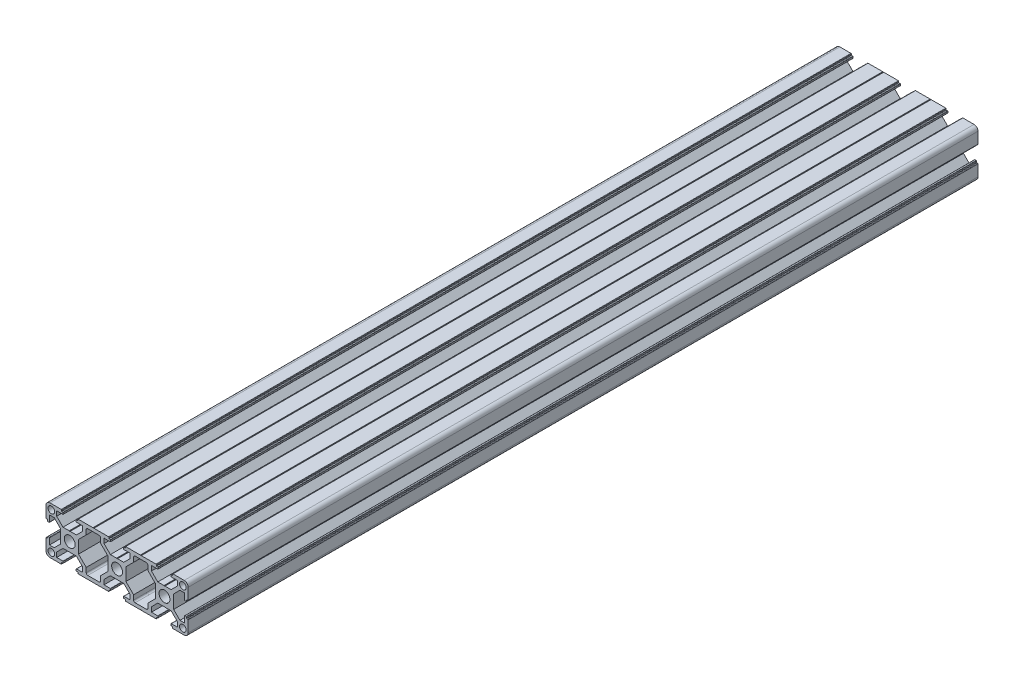
from build123d import *

# Parameters (mm, degrees)
SKETCH_1_R      = 2.1
SKETCH_1_R_2    = 3.45
EXTRUDE_1_DEPTH = 500


with BuildPart() as part:
    # Эскиз1 → Бобышка-Вытянуть1 (new body)
    with BuildSketch(Plane(origin=(0, 500, 0), x_dir=(1, 0, 0), z_dir=(0, 0, -1))):
        with BuildLine():
            Line((15.337695265, -15), (24.6, -15))
            ThreePointArc((24.6, -15), (24.741421356, -14.941421356), (24.8, -14.8))
            Line((24.8, -14.8), (24.8, -14.2))
            ThreePointArc((24.8, -14.2), (24.858578644, -14.058578644), (25, -14))
            Line((25, -14), (25.7, -14))
            ThreePointArc((25.7, -14), (25.841421356, -13.941421356), (25.9, -13.8))
            Line((25.9, -13.8), (25.9, -13))
            ThreePointArc((25.9, -13), (25.841421356, -12.858578644), (25.7, -12.8))
            Line((25.7, -12.8), (21.75, -12.8))
            Line((21.75, -12.8), (21.75, -9.805634919))
            Line((21.75, -9.805634919), (25.755634919, -5.8))
            Line((25.755634919, -5.8), (29.662304735, -5.8))
            ThreePointArc((29.662304735, -5.8), (29.745056471, -5.78590708), (29.818478497, -5.745217202))
            Line((29.818478497, -5.745217202), (30, -5.6))
            Line((30, -5.6), (30.181521503, -5.745217202))
            ThreePointArc((30.181521503, -5.745217202), (30.254943529, -5.78590708), (30.337695265, -5.8))
            Line((30.337695265, -5.8), (34.244365081, -5.8))
            Line((34.244365081, -5.8), (38.25, -9.805634919))
            Line((38.25, -9.805634919), (38.25, -12.8))
            Line((38.25, -12.8), (34.3, -12.8))
            ThreePointArc((34.3, -12.8), (34.158578644, -12.858578644), (34.1, -13))
            Line((34.1, -13), (34.1, -13.8))
            ThreePointArc((34.1, -13.8), (34.158578644, -13.941421356), (34.3, -14))
            Line((34.3, -14), (35, -14))
            ThreePointArc((35, -14), (35.141421356, -14.058578644), (35.2, -14.2))
            Line((35.2, -14.2), (35.2, -14.8))
            ThreePointArc((35.2, -14.8), (35.258578644, -14.941421356), (35.4, -15))
            Line((35.4, -15), (42.5, -15))
            ThreePointArc((42.5, -15), (44.267766953, -14.267766953), (45, -12.5))
            Line((45, -12.5), (45, -5.4))
            ThreePointArc((45, -5.4), (44.941421356, -5.258578644), (44.8, -5.2))
            Line((44.8, -5.2), (44.2, -5.2))
            ThreePointArc((44.2, -5.2), (44.058578644, -5.141421356), (44, -5))
            Line((44, -5), (44, -4.3))
            ThreePointArc((44, -4.3), (43.941421356, -4.158578644), (43.8, -4.1))
            Line((43.8, -4.1), (43, -4.1))
            ThreePointArc((43, -4.1), (42.858578644, -4.158578644), (42.8, -4.3))
            Line((42.8, -4.3), (42.8, -8.25))
            Line((42.8, -8.25), (39.805634919, -8.25))
            Line((39.805634919, -8.25), (35.8, -4.244365081))
            Line((35.8, -4.244365081), (35.8, 4.244365081))
            Line((35.8, 4.244365081), (39.805634919, 8.25))
            Line((39.805634919, 8.25), (42.8, 8.25))
            Line((42.8, 8.25), (42.8, 4.3))
            ThreePointArc((42.8, 4.3), (42.858578644, 4.158578644), (43, 4.1))
            Line((43, 4.1), (43.8, 4.1))
            ThreePointArc((43.8, 4.1), (43.941421356, 4.158578644), (44, 4.3))
            Line((44, 4.3), (44, 5))
            ThreePointArc((44, 5), (44.058578644, 5.141421356), (44.2, 5.2))
            Line((44.2, 5.2), (44.8, 5.2))
            ThreePointArc((44.8, 5.2), (44.941421356, 5.258578644), (45, 5.4))
            Line((45, 5.4), (45, 12.5))
            ThreePointArc((45, 12.5), (44.267766953, 14.267766953), (42.5, 15))
            Line((42.5, 15), (35.4, 15))
            ThreePointArc((35.4, 15), (35.258578644, 14.941421356), (35.2, 14.8))
            Line((35.2, 14.8), (35.2, 14.2))
            ThreePointArc((35.2, 14.2), (35.141421356, 14.058578644), (35, 14))
            Line((35, 14), (34.3, 14))
            ThreePointArc((34.3, 14), (34.158578644, 13.941421356), (34.1, 13.8))
            Line((34.1, 13.8), (34.1, 13))
            ThreePointArc((34.1, 13), (34.158578644, 12.858578644), (34.3, 12.8))
            Line((34.3, 12.8), (38.25, 12.8))
            Line((38.25, 12.8), (38.25, 9.805634919))
            Line((38.25, 9.805634919), (34.244365081, 5.8))
            Line((34.244365081, 5.8), (30.337695265, 5.8))
            ThreePointArc((30.337695265, 5.8), (30.254943529, 5.78590708), (30.181521503, 5.745217202))
            Line((30.181521503, 5.745217202), (30, 5.6))
            Line((30, 5.6), (29.818478497, 5.745217202))
            ThreePointArc((29.818478497, 5.745217202), (29.745056471, 5.78590708), (29.662304735, 5.8))
            Line((29.662304735, 5.8), (25.755634919, 5.8))
            Line((25.755634919, 5.8), (21.75, 9.805634919))
            Line((21.75, 9.805634919), (21.75, 12.8))
            Line((21.75, 12.8), (25.7, 12.8))
            ThreePointArc((25.7, 12.8), (25.841421356, 12.858578644), (25.9, 13))
            Line((25.9, 13), (25.9, 13.8))
            ThreePointArc((25.9, 13.8), (25.841421356, 13.941421356), (25.7, 14))
            Line((25.7, 14), (25, 14))
            ThreePointArc((25, 14), (24.858578644, 14.058578644), (24.8, 14.2))
            Line((24.8, 14.2), (24.8, 14.8))
            ThreePointArc((24.8, 14.8), (24.741421356, 14.941421356), (24.6, 15))
            Line((24.6, 15), (15.337695265, 15))
            ThreePointArc((15.337695265, 15), (15.254943529, 14.98590708), (15.181521503, 14.945217202))
            Line((15.181521503, 14.945217202), (15, 14.8))
            Line((15, 14.8), (14.818478497, 14.945217202))
            ThreePointArc((14.818478497, 14.945217202), (14.745056471, 14.98590708), (14.662304735, 15))
            Line((14.662304735, 15), (5.4, 15))
            ThreePointArc((5.4, 15), (5.258578644, 14.941421356), (5.2, 14.8))
            Line((5.2, 14.8), (5.2, 14.2))
            ThreePointArc((5.2, 14.2), (5.141421356, 14.058578644), (5, 14))
            Line((5, 14), (4.3, 14))
            ThreePointArc((4.3, 14), (4.158578644, 13.941421356), (4.1, 13.8))
            Line((4.1, 13.8), (4.1, 13))
            ThreePointArc((4.1, 13), (4.158578644, 12.858578644), (4.3, 12.8))
            Line((4.3, 12.8), (8.25, 12.8))
            Line((8.25, 12.8), (8.25, 9.805634919))
            Line((8.25, 9.805634919), (4.244365081, 5.8))
            Line((4.244365081, 5.8), (0.337695265, 5.8))
            ThreePointArc((0.337695265, 5.8), (0.254943529, 5.78590708), (0.181521503, 5.745217202))
            Line((0.181521503, 5.745217202), (0, 5.6))
            Line((0, 5.6), (-0.181521503, 5.745217202))
            ThreePointArc((-0.181521503, 5.745217202), (-0.254943529, 5.78590708), (-0.337695265, 5.8))
            Line((-0.337695265, 5.8), (-4.244365081, 5.8))
            Line((-4.244365081, 5.8), (-8.25, 9.805634919))
            Line((-8.25, 9.805634919), (-8.25, 12.8))
            Line((-8.25, 12.8), (-4.3, 12.8))
            ThreePointArc((-4.3, 12.8), (-4.158578644, 12.858578644), (-4.1, 13))
            Line((-4.1, 13), (-4.1, 13.8))
            ThreePointArc((-4.1, 13.8), (-4.158578644, 13.941421356), (-4.3, 14))
            Line((-4.3, 14), (-5, 14))
            ThreePointArc((-5, 14), (-5.141421356, 14.058578644), (-5.2, 14.2))
            Line((-5.2, 14.2), (-5.2, 14.8))
            ThreePointArc((-5.2, 14.8), (-5.258578644, 14.941421356), (-5.4, 15))
            Line((-5.4, 15), (-14.662304735, 15))
            ThreePointArc((-14.662304735, 15), (-14.745056471, 14.98590708), (-14.818478497, 14.945217202))
            Line((-14.818478497, 14.945217202), (-15, 14.8))
            Line((-15, 14.8), (-15.181521503, 14.945217202))
            ThreePointArc((-15.181521503, 14.945217202), (-15.254943529, 14.98590708), (-15.337695265, 15))
            Line((-15.337695265, 15), (-24.6, 15))
            ThreePointArc((-24.6, 15), (-24.741421356, 14.941421356), (-24.8, 14.8))
            Line((-24.8, 14.8), (-24.8, 14.2))
            ThreePointArc((-24.8, 14.2), (-24.858578644, 14.058578644), (-25, 14))
            Line((-25, 14), (-25.7, 14))
            ThreePointArc((-25.7, 14), (-25.841421356, 13.941421356), (-25.9, 13.8))
            Line((-25.9, 13.8), (-25.9, 13))
            ThreePointArc((-25.9, 13), (-25.841421356, 12.858578644), (-25.7, 12.8))
            Line((-25.7, 12.8), (-21.75, 12.8))
            Line((-21.75, 12.8), (-21.75, 9.805634919))
            Line((-21.75, 9.805634919), (-25.755634919, 5.8))
            Line((-25.755634919, 5.8), (-29.662304735, 5.8))
            ThreePointArc((-29.662304735, 5.8), (-29.745056471, 5.78590708), (-29.818478497, 5.745217202))
            Line((-29.818478497, 5.745217202), (-30, 5.6))
            Line((-30, 5.6), (-30.181521503, 5.745217202))
            ThreePointArc((-30.181521503, 5.745217202), (-30.254943529, 5.78590708), (-30.337695265, 5.8))
            Line((-30.337695265, 5.8), (-34.244365081, 5.8))
            Line((-34.244365081, 5.8), (-38.25, 9.805634919))
            Line((-38.25, 9.805634919), (-38.25, 12.8))
            Line((-38.25, 12.8), (-34.3, 12.8))
            ThreePointArc((-34.3, 12.8), (-34.158578644, 12.858578644), (-34.1, 13))
            Line((-34.1, 13), (-34.1, 13.8))
            ThreePointArc((-34.1, 13.8), (-34.158578644, 13.941421356), (-34.3, 14))
            Line((-34.3, 14), (-35, 14))
            ThreePointArc((-35, 14), (-35.141421356, 14.058578644), (-35.2, 14.2))
            Line((-35.2, 14.2), (-35.2, 14.8))
            ThreePointArc((-35.2, 14.8), (-35.258578644, 14.941421356), (-35.4, 15))
            Line((-35.4, 15), (-42.5, 15))
            ThreePointArc((-42.5, 15), (-44.267766953, 14.267766953), (-45, 12.5))
            Line((-45, 12.5), (-45, 5.4))
            ThreePointArc((-45, 5.4), (-44.941421356, 5.258578644), (-44.8, 5.2))
            Line((-44.8, 5.2), (-44.2, 5.2))
            ThreePointArc((-44.2, 5.2), (-44.058578644, 5.141421356), (-44, 5))
            Line((-44, 5), (-44, 4.3))
            ThreePointArc((-44, 4.3), (-43.941421356, 4.158578644), (-43.8, 4.1))
            Line((-43.8, 4.1), (-43, 4.1))
            ThreePointArc((-43, 4.1), (-42.858578644, 4.158578644), (-42.8, 4.3))
            Line((-42.8, 4.3), (-42.8, 8.25))
            Line((-42.8, 8.25), (-39.805634919, 8.25))
            Line((-39.805634919, 8.25), (-35.8, 4.244365081))
            Line((-35.8, 4.244365081), (-35.8, -4.244365081))
            Line((-35.8, -4.244365081), (-39.805634919, -8.25))
            Line((-39.805634919, -8.25), (-42.8, -8.25))
            Line((-42.8, -8.25), (-42.8, -4.3))
            ThreePointArc((-42.8, -4.3), (-42.858578644, -4.158578644), (-43, -4.1))
            Line((-43, -4.1), (-43.8, -4.1))
            ThreePointArc((-43.8, -4.1), (-43.941421356, -4.158578644), (-44, -4.3))
            Line((-44, -4.3), (-44, -5))
            ThreePointArc((-44, -5), (-44.058578644, -5.141421356), (-44.2, -5.2))
            Line((-44.2, -5.2), (-44.8, -5.2))
            ThreePointArc((-44.8, -5.2), (-44.941421356, -5.258578644), (-45, -5.4))
            Line((-45, -5.4), (-45, -12.5))
            ThreePointArc((-45, -12.5), (-44.267766953, -14.267766953), (-42.5, -15))
            Line((-42.5, -15), (-35.4, -15))
            ThreePointArc((-35.4, -15), (-35.258578644, -14.941421356), (-35.2, -14.8))
            Line((-35.2, -14.8), (-35.2, -14.2))
            ThreePointArc((-35.2, -14.2), (-35.141421356, -14.058578644), (-35, -14))
            Line((-35, -14), (-34.3, -14))
            ThreePointArc((-34.3, -14), (-34.158578644, -13.941421356), (-34.1, -13.8))
            Line((-34.1, -13.8), (-34.1, -13))
            ThreePointArc((-34.1, -13), (-34.158578644, -12.858578644), (-34.3, -12.8))
            Line((-34.3, -12.8), (-38.25, -12.8))
            Line((-38.25, -12.8), (-38.25, -9.805634919))
            Line((-38.25, -9.805634919), (-34.244365081, -5.8))
            Line((-34.244365081, -5.8), (-30.337695265, -5.8))
            ThreePointArc((-30.337695265, -5.8), (-30.254943529, -5.78590708), (-30.181521503, -5.745217202))
            Line((-30.181521503, -5.745217202), (-30, -5.6))
            Line((-30, -5.6), (-29.818478497, -5.745217202))
            ThreePointArc((-29.818478497, -5.745217202), (-29.745056471, -5.78590708), (-29.662304735, -5.8))
            Line((-29.662304735, -5.8), (-25.755634919, -5.8))
            Line((-25.755634919, -5.8), (-21.75, -9.805634919))
            Line((-21.75, -9.805634919), (-21.75, -12.8))
            Line((-21.75, -12.8), (-25.7, -12.8))
            ThreePointArc((-25.7, -12.8), (-25.841421356, -12.858578644), (-25.9, -13))
            Line((-25.9, -13), (-25.9, -13.8))
            ThreePointArc((-25.9, -13.8), (-25.841421356, -13.941421356), (-25.7, -14))
            Line((-25.7, -14), (-25, -14))
            ThreePointArc((-25, -14), (-24.858578644, -14.058578644), (-24.8, -14.2))
            Line((-24.8, -14.2), (-24.8, -14.8))
            ThreePointArc((-24.8, -14.8), (-24.741421356, -14.941421356), (-24.6, -15))
            Line((-24.6, -15), (-15.337695265, -15))
            ThreePointArc((-15.337695265, -15), (-15.254943529, -14.98590708), (-15.181521503, -14.945217202))
            Line((-15.181521503, -14.945217202), (-15, -14.8))
            Line((-15, -14.8), (-14.818478497, -14.945217202))
            ThreePointArc((-14.818478497, -14.945217202), (-14.745056471, -14.98590708), (-14.662304735, -15))
            Line((-14.662304735, -15), (-5.4, -15))
            ThreePointArc((-5.4, -15), (-5.258578644, -14.941421356), (-5.2, -14.8))
            Line((-5.2, -14.8), (-5.2, -14.2))
            ThreePointArc((-5.2, -14.2), (-5.141421356, -14.058578644), (-5, -14))
            Line((-5, -14), (-4.3, -14))
            ThreePointArc((-4.3, -14), (-4.158578644, -13.941421356), (-4.1, -13.8))
            Line((-4.1, -13.8), (-4.1, -13))
            ThreePointArc((-4.1, -13), (-4.158578644, -12.858578644), (-4.3, -12.8))
            Line((-4.3, -12.8), (-8.25, -12.8))
            Line((-8.25, -12.8), (-8.25, -9.805634919))
            Line((-8.25, -9.805634919), (-4.244365081, -5.8))
            Line((-4.244365081, -5.8), (-0.337695265, -5.8))
            ThreePointArc((-0.337695265, -5.8), (-0.254943529, -5.78590708), (-0.181521503, -5.745217202))
            Line((-0.181521503, -5.745217202), (0, -5.6))
            Line((0, -5.6), (0.181521503, -5.745217202))
            ThreePointArc((0.181521503, -5.745217202), (0.254943529, -5.78590708), (0.337695265, -5.8))
            Line((0.337695265, -5.8), (4.244365081, -5.8))
            Line((4.244365081, -5.8), (8.25, -9.805634919))
            Line((8.25, -9.805634919), (8.25, -12.8))
            Line((8.25, -12.8), (4.3, -12.8))
            ThreePointArc((4.3, -12.8), (4.158578644, -12.858578644), (4.1, -13))
            Line((4.1, -13), (4.1, -13.8))
            ThreePointArc((4.1, -13.8), (4.158578644, -13.941421356), (4.3, -14))
            Line((4.3, -14), (5, -14))
            ThreePointArc((5, -14), (5.141421356, -14.058578644), (5.2, -14.2))
            Line((5.2, -14.2), (5.2, -14.8))
            ThreePointArc((5.2, -14.8), (5.258578644, -14.941421356), (5.4, -15))
            Line((5.4, -15), (14.662304735, -15))
            ThreePointArc((14.662304735, -15), (14.745056471, -14.98590708), (14.818478497, -14.945217202))
            Line((14.818478497, -14.945217202), (15, -14.8))
            Line((15, -14.8), (15.181521503, -14.945217202))
            ThreePointArc((15.181521503, -14.945217202), (15.254943529, -14.98590708), (15.337695265, -15))
        make_face()
        with Locations((41.625, -11.625)):
            Circle(SKETCH_1_R, mode=Mode.SUBTRACT)
        with Locations((41.625, 11.625)):
            Circle(SKETCH_1_R, mode=Mode.SUBTRACT)
        with Locations((-41.625, 11.625)):
            Circle(SKETCH_1_R, mode=Mode.SUBTRACT)
        with Locations((-41.625, -11.625)):
            Circle(SKETCH_1_R, mode=Mode.SUBTRACT)
        with Locations((30, 0)):
            Circle(SKETCH_1_R_2, mode=Mode.SUBTRACT)
        with Locations((-30, 0)):
            Circle(SKETCH_1_R_2, mode=Mode.SUBTRACT)
        Circle(SKETCH_1_R_2, mode=Mode.SUBTRACT)
        with BuildLine():
            Line((-18.55, 12.8), (-11.45, 12.8))
            ThreePointArc((-11.45, 12.8), (-10.742893219, 12.507106781), (-10.45, 11.8))
            Line((-10.45, 11.8), (-10.45, 8.894365081))
            Line((-10.45, 8.894365081), (-5.6, 4.044365081))
            Line((-5.6, 4.044365081), (-5.6, -4.044365081))
            Line((-5.6, -4.044365081), (-10.45, -8.894365081))
            Line((-10.45, -8.894365081), (-10.45, -11.8))
            ThreePointArc((-10.45, -11.8), (-10.742893219, -12.507106781), (-11.45, -12.8))
            Line((-11.45, -12.8), (-18.55, -12.8))
            ThreePointArc((-18.55, -12.8), (-19.257106781, -12.507106781), (-19.55, -11.8))
            Line((-19.55, -11.8), (-19.55, -8.894365081))
            Line((-19.55, -8.894365081), (-24.4, -4.044365081))
            Line((-24.4, -4.044365081), (-24.4, 4.044365081))
            Line((-24.4, 4.044365081), (-19.55, 8.894365081))
            Line((-19.55, 8.894365081), (-19.55, 11.8))
            ThreePointArc((-19.55, 11.8), (-19.257106781, 12.507106781), (-18.55, 12.8))
        make_face(mode=Mode.SUBTRACT)
        with BuildLine():
            Line((19.55, 11.8), (19.55, 8.894365081))
            Line((19.55, 8.894365081), (24.4, 4.044365081))
            Line((24.4, 4.044365081), (24.4, -4.044365081))
            Line((24.4, -4.044365081), (19.55, -8.894365081))
            Line((19.55, -8.894365081), (19.55, -11.8))
            ThreePointArc((19.55, -11.8), (19.257106781, -12.507106781), (18.55, -12.8))
            Line((18.55, -12.8), (11.45, -12.8))
            ThreePointArc((11.45, -12.8), (10.742893219, -12.507106781), (10.45, -11.8))
            Line((10.45, -11.8), (10.45, -8.894365081))
            Line((10.45, -8.894365081), (5.6, -4.044365081))
            Line((5.6, -4.044365081), (5.6, 4.044365081))
            Line((5.6, 4.044365081), (10.45, 8.894365081))
            Line((10.45, 8.894365081), (10.45, 11.8))
            ThreePointArc((10.45, 11.8), (10.742893219, 12.507106781), (11.45, 12.8))
            Line((11.45, 12.8), (18.55, 12.8))
            ThreePointArc((18.55, 12.8), (19.257106781, 12.507106781), (19.55, 11.8))
        make_face(mode=Mode.SUBTRACT)
    extrude(amount=-EXTRUDE_1_DEPTH)


solid = part.part
